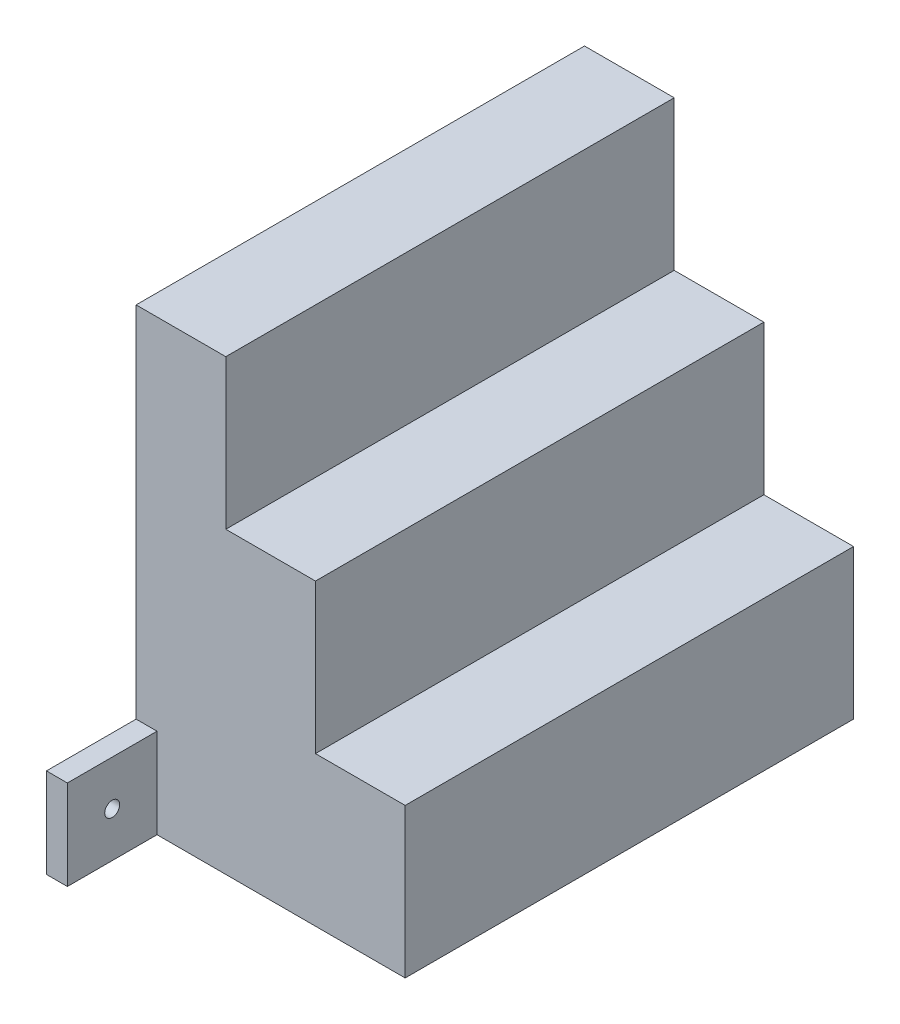
from build123d import *

# Parameters (mm, degrees)
BOSS_EXTRUDE1_DEPTH = 190.5
SKETCH2_W           = 76.2
SKETCH2_H           = 76.2
SKETCH2_R           = 6.35
BOSS_EXTRUDE2_DEPTH = 17.78


with BuildPart() as part:
    # Sketch1 → Boss-Extrude1 (new, symmetric)
    with BuildSketch(Plane.XY):
        Polygon((0, 0), (0, 381), (76.2, 381), (76.2, 254), (152.4, 254), (152.4, 127), (228.6, 127), (228.6, 0), align=None)
    extrude(amount=BOSS_EXTRUDE1_DEPTH, both=True)

    # Sketch2 → Boss-Extrude2 (add)
    # profile 1 of 2: a face of its own
    with BuildSketch(Plane.ZY):
        with Locations((228.6, 38.1)):
            Rectangle(SKETCH2_W, SKETCH2_H)
        with Locations((228.6, 38.1)):
            Circle(SKETCH2_R, mode=Mode.SUBTRACT)
    # profile 2 of 2: a face of its own
    with BuildSketch(Plane.ZY):
        with Locations((-228.6, 38.1)):
            Rectangle(SKETCH2_W, SKETCH2_H)
        with Locations((-228.6, 38.1)):
            Circle(SKETCH2_R, mode=Mode.SUBTRACT)
    extrude(amount=-BOSS_EXTRUDE2_DEPTH)


solid = part.part
